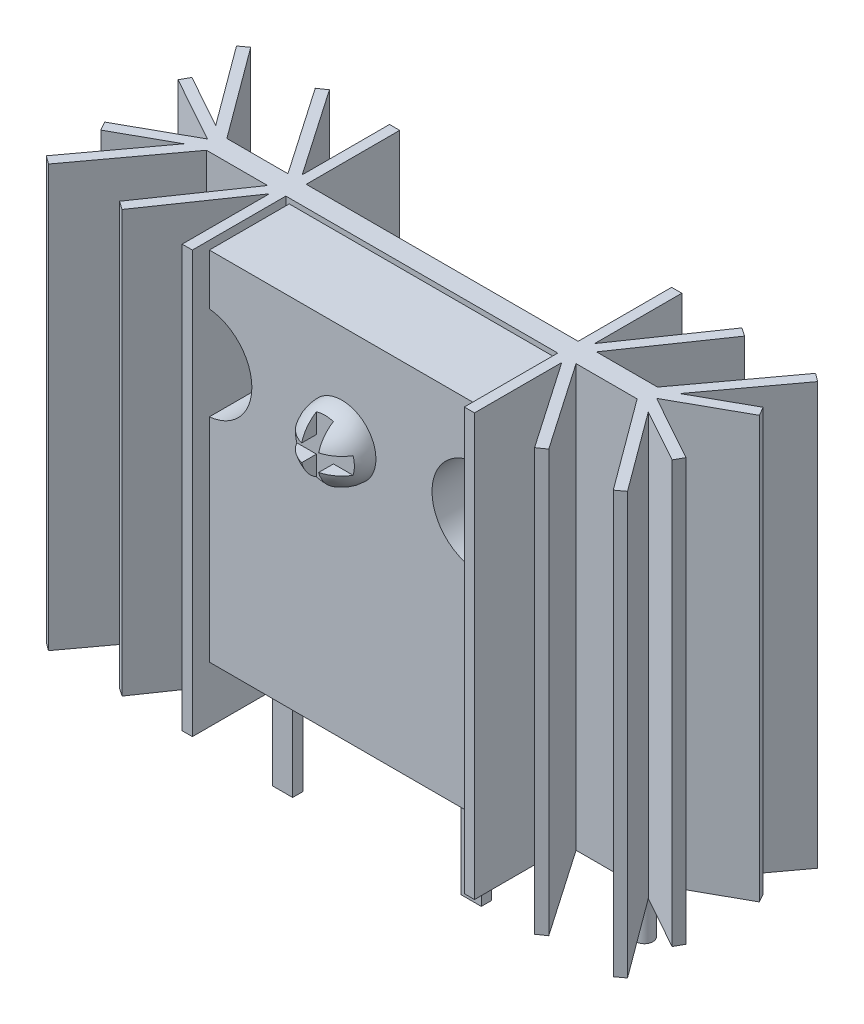
from build123d import *

# Parameters (mm, degrees)
CROQUIS1_W                = 25.8
CROQUIS1_H                = 24.8
SALIENTE_EXTRUIR1_DEPTH   = 1.2
CROQUIS2_W                = 0.6
CROQUIS2_H                = 24.8
SALIENTE_EXTRUIR2_DEPTH   = 5.5
SALIENTE_EXTRUIR3_DEPTH   = 24.8
SIMETR_A2_COPY_1_SKETCH_W = 0.6
SIMETR_A2_COPY_1_SKETCH_H = 24.8
SIMETR_A2_COPY_1_DEPTH    = 5.5
SIMETR_A2_COPY_2_DEPTH    = 24.8
CROQUIS4_R                = 0.5
SALIENTE_EXTRUIR4_DEPTH   = 3
SALIENTE_EXTRUIR5_DEPTH   = 4.7
CROQUIS6_W                = 1.2
CROQUIS6_H                = 0.6
SALIENTE_EXTRUIR6_DEPTH   = 6.5
SALIENTE_EXTRUIR6_2_DEPTH = 6.5
CORTAR_EXTRUIR1_DEPTH     = 1


with BuildPart() as part:
    # Croquis1 → Saliente-Extruir1 (new body)
    with BuildSketch(Plane.XY):
        with Locations((0, 12.4)):
            Rectangle(CROQUIS1_W, CROQUIS1_H)
    extrude(amount=-SALIENTE_EXTRUIR1_DEPTH)

    # Croquis2 → Saliente-Extruir2 (add)
    with BuildSketch(Plane.XY):
        with Locations((8.3, 12.4)):
            Rectangle(CROQUIS2_W, CROQUIS2_H)
    saliente_extruir2 = extrude(amount=SALIENTE_EXTRUIR2_DEPTH)

    # Croquis3 → Saliente-Extruir3 (add)
    with BuildSketch(Plane(origin=(0, 24.8, 0), x_dir=(1, 0, 0), z_dir=(0, 1, 0))):
        Polygon((8.17004472, 0.25973896), (12.135766627, -5.5), (12.62995528, -5.15973896), (8.664233373, 0.6), align=None)
        Polygon((12.227201436, 0.6), (16.617165522, -5.350840205), (17.1, -4.994650836), (13.660671044, -0.332449363), (16.808614241, -2.081306694), (17.1, -1.556812329), (12.802701866, 0.830575524), (12.710035914, 0.956189369), align=None)
    saliente_extruir3 = extrude(amount=-SALIENTE_EXTRUIR3_DEPTH)

    # Simetría1: Saliente-Extruir2, Saliente-Extruir3 across plane
    add(saliente_extruir2.mirror(Plane.XY.offset(-0.6)))
    add(saliente_extruir3.mirror(Plane.XY.offset(-0.6)))

    # Simetría2: Saliente-Extruir2, Saliente-Extruir3 across plane
    add(saliente_extruir2.mirror(Plane(origin=(0, 0, 0), x_dir=(0, 0, 1), z_dir=(1, 0, 0))))
    add(saliente_extruir3.mirror(Plane(origin=(0, 0, 0), x_dir=(0, 0, 1), z_dir=(1, 0, 0))))

    # Simetría2 copy 1 sketch → Simetría2 copy 1 (add)
    with BuildSketch(Plane(origin=(0, 0, -1.2), x_dir=(-1, 0, 0), z_dir=(0, 0, -1))):
        with Locations((8.3, 12.4)):
            Rectangle(SIMETR_A2_COPY_1_SKETCH_W, SIMETR_A2_COPY_1_SKETCH_H)
    extrude(amount=SIMETR_A2_COPY_1_DEPTH)

    # Simetría2 copy 2 sketch → Simetría2 copy 2 (add)
    with BuildSketch(Plane(origin=(0, 24.8, -1.2), x_dir=(-1, 0, 0), z_dir=(0, 1, 0))):
        Polygon((8.17004472, 0.25973896), (12.135766627, -5.5), (12.62995528, -5.15973896), (8.664233373, 0.6), align=None)
        Polygon((12.227201436, 0.6), (16.617165522, -5.350840205), (17.1, -4.994650836), (13.660671044, -0.332449363), (16.808614241, -2.081306694), (17.1, -1.556812329), (12.802701866, 0.830575524), (12.710035914, 0.956189369), align=None)
    extrude(amount=-SIMETR_A2_COPY_2_DEPTH)

    # Croquis4 → Saliente-Extruir4 (add)
    with BuildSketch(Plane.XZ):
        with Locations((12.5, -0.6)):
            Circle(CROQUIS4_R)
        with Locations(Location((-12.5, -0.6, 0), (0, 0, 180))):
            Circle(CROQUIS4_R)
    extrude(amount=SALIENTE_EXTRUIR4_DEPTH)


with BuildPart() as body_2:
    # Croquis5 → Saliente-Extruir5 (new body)
    with BuildSketch(Plane.XY):
        with BuildLine():
            Line((-7.8, 24.5), (7.8, 24.5))
            Line((7.8, 24.5), (7.8, 21.5))
            ThreePointArc((7.8, 21.5), (5.3, 18.75), (7.8, 16))
            Line((7.8, 16), (7.8, 3.5))
            Line((7.8, 3.5), (-7.8, 3.5))
            Line((-7.8, 3.5), (-7.8, 16))
            ThreePointArc((-7.8, 16), (-5.3, 18.75), (-7.8, 21.5))
            Line((-7.8, 21.5), (-7.8, 24.5))
        make_face()
    extrude(amount=SALIENTE_EXTRUIR5_DEPTH)


with BuildPart() as body_3:
    # Croquis6 → Saliente-Extruir6 (new body)
    with BuildSketch(Plane.XZ.offset(-3.5)):
        with Locations((-5.55, 2.35)):
            Rectangle(CROQUIS6_W, CROQUIS6_H)
    extrude(amount=SALIENTE_EXTRUIR6_DEPTH)


with BuildPart() as body_4:
    # Croquis6 → Saliente-Extruir6 2 (new body)
    with BuildSketch(Plane.XZ.offset(-3.5)):
        with Locations((5.55, 2.35)):
            Rectangle(CROQUIS6_W, CROQUIS6_H)
    extrude(amount=SALIENTE_EXTRUIR6_2_DEPTH)


with BuildPart() as body_5:
    # Croquis7 → Revolución1 (revolve)
    with BuildSketch(Plane(origin=(0, 0, 0), x_dir=(0, 0, -1), z_dir=(1, 0, 0))):
        with BuildLine():
            Line((-4.7, 18.75), (-6.7, 18.75))
            ThreePointArc((-6.7, 18.75), (-6.114213562, 20.164213562), (-4.7, 20.75))
            Line((-4.7, 20.75), (-4.7, 18.75))
        make_face()
    revolve(axis=Axis((0, 18.75, 4.7), (0, 0, 1)))

    # Croquis8 → Cortar-Extruir1 (cut)
    with BuildSketch(Plane.XY.offset(6.7)):
        Polygon((0.5, 18.25), (1.936491673, 18.25), (1.936491673, 19.25), (0.5, 19.25), (0.5, 20.686491673), (-0.5, 20.686491673), (-0.5, 19.25), (-1.936491673, 19.25), (-1.936491673, 18.25), (-0.5, 18.25), (-0.5, 16.813508327), (0.5, 16.813508327), align=None)
    extrude(amount=-CORTAR_EXTRUIR1_DEPTH, mode=Mode.SUBTRACT)


solid = Compound([part.part, body_2.part, body_3.part, body_4.part, body_5.part])
